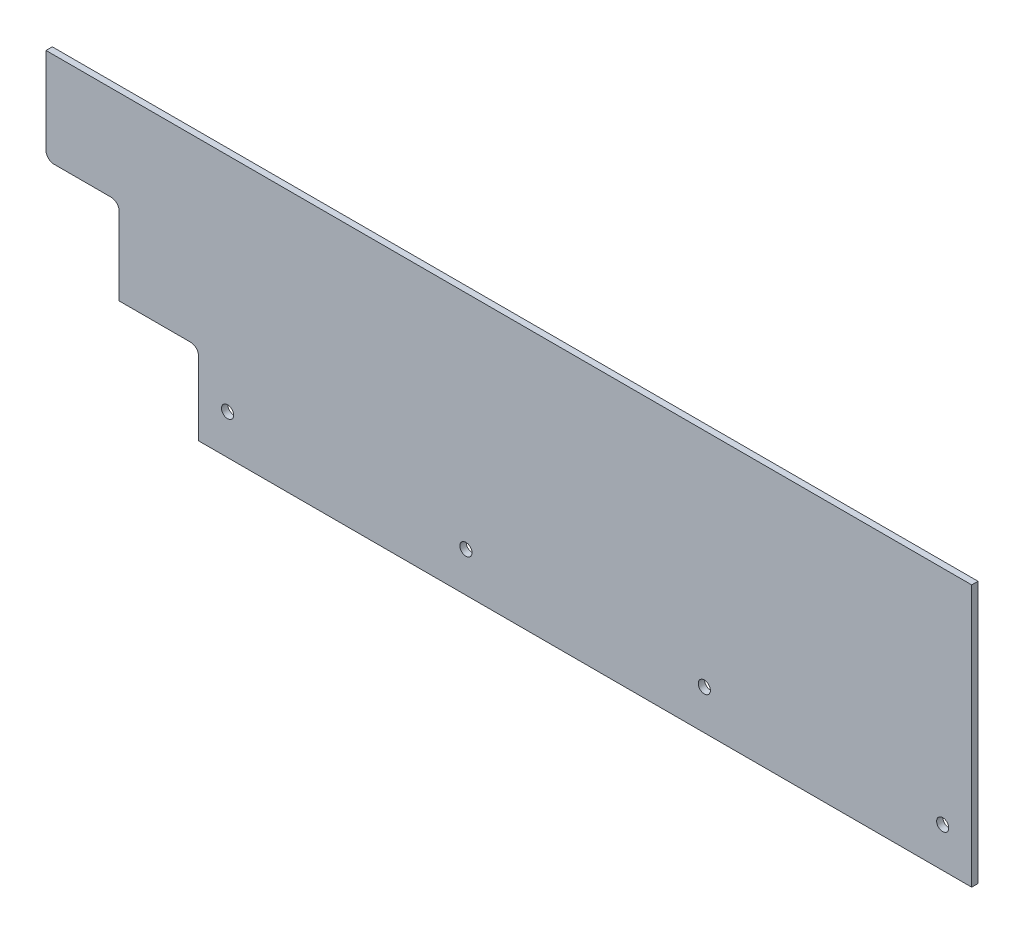
from build123d import *

# Parameters (mm, degrees)
SKETCH1_R           = 3.05
BOSS_EXTRUDE1_DEPTH = 3.175


with BuildPart() as part:
    # Sketch1 → Boss-Extrude1 (new body)
    with BuildSketch(Plane.XY):
        with BuildLine():
            Line((-466, 88.2), (-466, 131.8))
            Line((-466, 131.8), (0, 131.8))
            Line((0, 131.8), (0, 0))
            Line((0, 0), (-389.2, 0))
            Line((-389.2, 0), (-389.2, 37))
            ThreePointArc((-389.2, 37), (-390.371572875, 39.828427125), (-393.2, 41))
            Line((-393.2, 41), (-429.2, 41))
            Line((-429.2, 41), (-429.2, 80.2))
            ThreePointArc((-429.2, 80.2), (-430.371572875, 83.028427125), (-433.2, 84.2))
            Line((-433.2, 84.2), (-462, 84.2))
            ThreePointArc((-462, 84.2), (-464.828427125, 85.371572875), (-466, 88.2))
        make_face()
        with Locations(Location((-14.6, 20, 0), (0, 0, 180))):
            Circle(SKETCH1_R, mode=Mode.SUBTRACT)
        with Locations(Location((-134.6, 20, 0), (0, 0, 180))):
            Circle(SKETCH1_R, mode=Mode.SUBTRACT)
        with Locations(Location((-254.6, 20, 0), (0, 0, 180))):
            Circle(SKETCH1_R, mode=Mode.SUBTRACT)
        with Locations(Location((-374.6, 20, 0), (0, 0, 180))):
            Circle(SKETCH1_R, mode=Mode.SUBTRACT)
    extrude(amount=BOSS_EXTRUDE1_DEPTH)


solid = part.part
